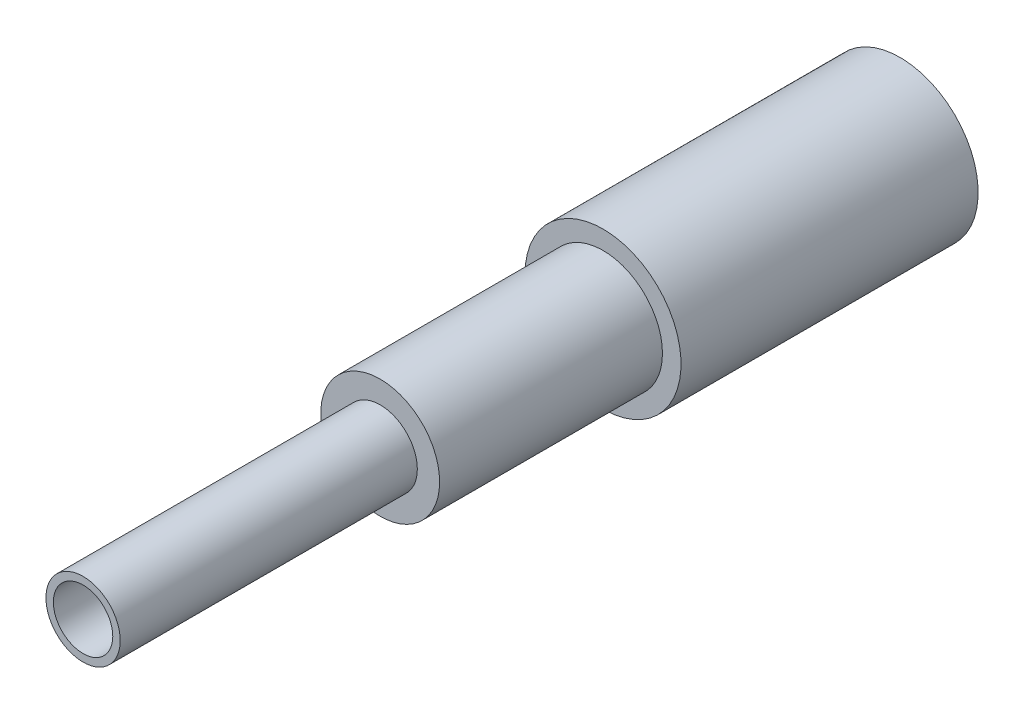
from build123d import *

# Parameters (mm, degrees)
SKETCH1_R           = 8
BOSS_EXTRUDE2_DEPTH = 30
SKETCH2_R           = 5
BOSS_EXTRUDE3_DEPTH = 40
SKETCH4_R           = 10.5
BOSS_EXTRUDE4_DEPTH = 40
SHELL1_T            = -1
CUT_EXTRUDE2_REACH  = 112.998
SKETCH5_R           = 9.5


with BuildPart() as part:
    # Sketch1 → Boss-Extrude2 (new body)
    with BuildSketch(Plane.XY):
        Circle(SKETCH1_R)
    extrude(amount=BOSS_EXTRUDE2_DEPTH)

    # Sketch2 → Boss-Extrude3 (add)
    with BuildSketch(Plane.XY.offset(30)):
        Circle(SKETCH2_R)
    extrude(amount=BOSS_EXTRUDE3_DEPTH)

    # Sketch4 → Boss-Extrude4 (add)
    with BuildSketch(Plane(origin=(0, 0, 0), x_dir=(-1, 0, 0), z_dir=(0, 0, -1))):
        Circle(SKETCH4_R)
    extrude(amount=BOSS_EXTRUDE4_DEPTH)

    # Shell1
    shell1_openings = [part.faces().sort_by_distance(p)[0] for p in [
        (0, 0, 70),
    ]]
    offset(amount=SHELL1_T, openings=shell1_openings, kind=Kind.INTERSECTION)

    # Sketch5 → Cut-Extrude2 (cut, up to next)
    with BuildSketch(Plane(origin=(0, 0, -40), x_dir=(-1, 0, 0), z_dir=(0, 0, -1)), mode=Mode.PRIVATE) as cut_extrude2_sk1:
        Circle(SKETCH5_R)
    cut_extrude2_tool1 = extrude(cut_extrude2_sk1.sketch, amount=-CUT_EXTRUDE2_REACH, mode=Mode.PRIVATE) & part.part
    add(cut_extrude2_tool1.solids().sort_by_distance((0, 0, -40))[0], mode=Mode.SUBTRACT)


solid = part.part
